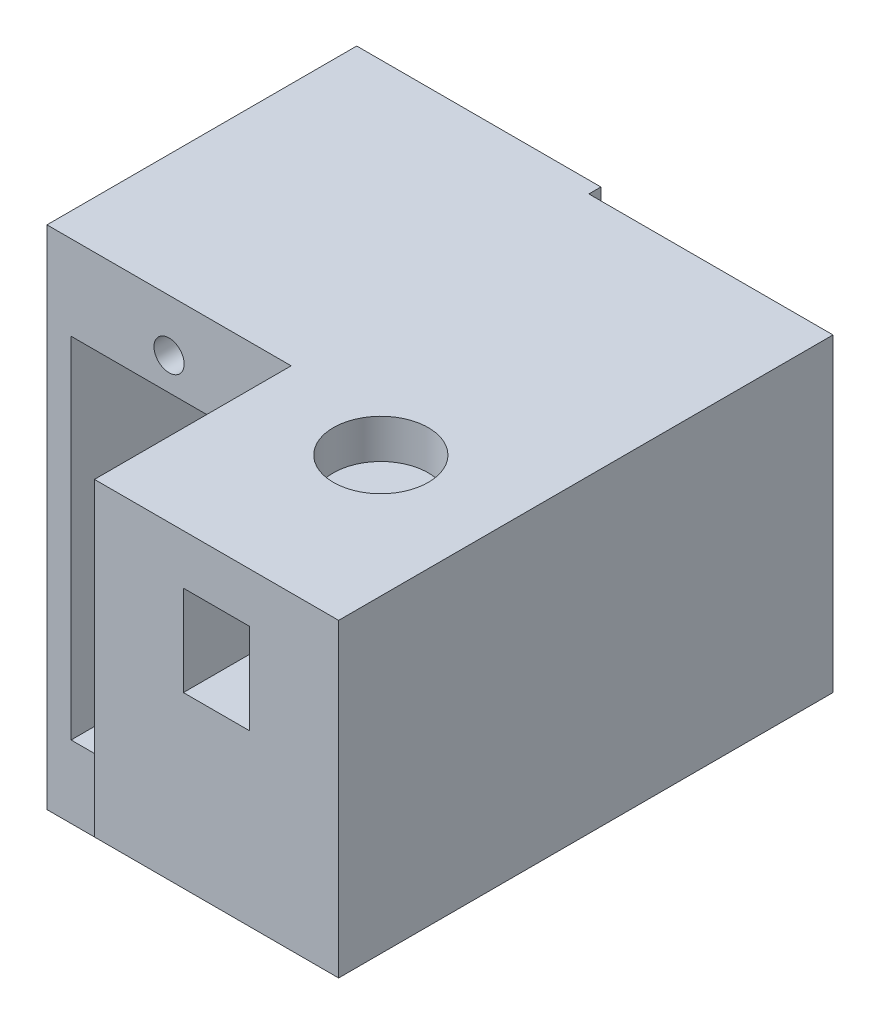
from build123d import *

# Parameters (mm, degrees)
BOSS_EXTRUDE1_START = -17.075
SKETCH1_W           = 16.2
SKETCH1_H           = 32.8
BOSS_EXTRUDE1_DEPTH = 10.275
BOSS_EXTRUDE2_START = -12.425
SKETCH2_W           = 16.2
SKETCH2_H           = 32.8
BOSS_EXTRUDE2_DEPTH = 10.275
BOSS_EXTRUDE3_START = -7.3
SKETCH3_W           = 16.2
SKETCH3_H           = 20.55
BOSS_EXTRUDE3_DEPTH = 0.5
CUT_EXTRUDE1_START  = -18.725
SKETCH4_W           = 13
SKETCH4_H           = 23.2
CUT_EXTRUDE1_DEPTH  = 8.625
CUT_EXTRUDE2_START  = -24.35
SKETCH5_R           = 1
CUT_EXTRUDE2_DEPTH  = 3
CUT_EXTRUDE3_START  = -24.35
SKETCH6_R           = 1
CUT_EXTRUDE3_DEPTH  = 3
CUT_EXTRUDE4_START  = -8.1
SKETCH7_R           = 3.15
CUT_EXTRUDE4_DEPTH  = 1.3
CUT_EXTRUDE5_START  = 8.5
SKETCH8_W           = 4.4
SKETCH8_H           = 6
CUT_EXTRUDE5_DEPTH  = 2.4
CUT_EXTRUDE6_START  = -10.775
SKETCH9_W           = 13
SKETCH9_H           = 23.2
CUT_EXTRUDE6_DEPTH  = 8.625
CUT_EXTRUDE7_START  = -5.15
SKETCH10_R          = 1
CUT_EXTRUDE7_DEPTH  = 3
CUT_EXTRUDE8_START  = -5.15
SKETCH11_R          = 1
CUT_EXTRUDE8_DEPTH  = 3
CUT_EXTRUDE9_START  = -21.4
SKETCH12_R          = 3.15
CUT_EXTRUDE9_DEPTH  = 1.3
CUT_EXTRUDE10_START = -10
SKETCH13_W          = 4.4
SKETCH13_H          = 6
CUT_EXTRUDE10_DEPTH = 2.4


with BuildPart() as part:
    # Sketch1 → Boss-Extrude1 (new, symmetric)
    with BuildSketch(Plane(origin=(0, 0, 0), x_dir=(1, 0, 0), z_dir=(0, 1, 0)).offset(BOSS_EXTRUDE1_START)):
        with Locations((0, 5.5)):
            Rectangle(SKETCH1_W, SKETCH1_H)
    extrude(amount=BOSS_EXTRUDE1_DEPTH, both=True)

    # Sketch2 → Boss-Extrude2 (add, symmetric)
    with BuildSketch(Plane.XY.offset(BOSS_EXTRUDE2_START)):
        with Locations((-16.2, -24)):
            Rectangle(SKETCH2_W, SKETCH2_H)
    extrude(amount=BOSS_EXTRUDE2_DEPTH, both=True)

    # Sketch3 → Boss-Extrude3 (add, symmetric)
    with BuildSketch(Plane(origin=(0, 0, 0), x_dir=(1, 0, 0), z_dir=(0, 1, 0)).offset(BOSS_EXTRUDE3_START)):
        with Locations((-16.2, 12.425)):
            Rectangle(SKETCH3_W, SKETCH3_H)
    extrude(amount=BOSS_EXTRUDE3_DEPTH, both=True)

    # Sketch4 → Cut-Extrude1 (cut, symmetric)
    with BuildSketch(Plane(origin=(0, 0, 0), x_dir=(1, 0, 0), z_dir=(0, 1, 0)).offset(CUT_EXTRUDE1_START)):
        with Locations((0, 5.5)):
            Rectangle(SKETCH4_W, SKETCH4_H)
    extrude(amount=CUT_EXTRUDE1_DEPTH, both=True, mode=Mode.SUBTRACT)

    # Sketch5 → Cut-Extrude2 (cut, symmetric)
    with BuildSketch(Plane(origin=(0, 0, 0), x_dir=(1, 0, 0), z_dir=(0, 1, 0)).offset(CUT_EXTRUDE2_START)):
        with Locations(Location((0, 19.25, 0), (0, 0, 270))):
            Circle(SKETCH5_R)
    extrude(amount=CUT_EXTRUDE2_DEPTH, both=True, mode=Mode.SUBTRACT)

    # Sketch6 → Cut-Extrude3 (cut, symmetric)
    with BuildSketch(Plane(origin=(0, 0, 0), x_dir=(1, 0, 0), z_dir=(0, 1, 0)).offset(CUT_EXTRUDE3_START)):
        with Locations(Location((0, -8.25, 0), (0, 0, 270))):
            Circle(SKETCH6_R)
    extrude(amount=CUT_EXTRUDE3_DEPTH, both=True, mode=Mode.SUBTRACT)

    # Sketch7 → Cut-Extrude4 (cut, symmetric)
    with BuildSketch(Plane(origin=(0, 0, 0), x_dir=(1, 0, 0), z_dir=(0, 1, 0)).offset(CUT_EXTRUDE4_START)):
        with Locations(Location((0, 0, 0), (0, 0, 270))):
            Circle(SKETCH7_R)
    extrude(amount=CUT_EXTRUDE4_DEPTH, both=True, mode=Mode.SUBTRACT)

    # Sketch8 → Cut-Extrude5 (cut, symmetric)
    with BuildSketch(Plane.XY.offset(CUT_EXTRUDE5_START)):
        with Locations((0, -13.1)):
            Rectangle(SKETCH8_W, SKETCH8_H)
    extrude(amount=CUT_EXTRUDE5_DEPTH, both=True, mode=Mode.SUBTRACT)

    # Sketch9 → Cut-Extrude6 (cut, symmetric)
    with BuildSketch(Plane.XY.offset(CUT_EXTRUDE6_START)):
        with Locations((-16.2, -24)):
            Rectangle(SKETCH9_W, SKETCH9_H)
    extrude(amount=CUT_EXTRUDE6_DEPTH, both=True, mode=Mode.SUBTRACT)

    # Sketch10 → Cut-Extrude7 (cut, symmetric)
    with BuildSketch(Plane.XY.offset(CUT_EXTRUDE7_START)):
        with Locations((-16.2, -37.75)):
            Circle(SKETCH10_R)
    extrude(amount=CUT_EXTRUDE7_DEPTH, both=True, mode=Mode.SUBTRACT)

    # Sketch11 → Cut-Extrude8 (cut, symmetric)
    with BuildSketch(Plane.XY.offset(CUT_EXTRUDE8_START)):
        with Locations((-16.2, -10.25)):
            Circle(SKETCH11_R)
    extrude(amount=CUT_EXTRUDE8_DEPTH, both=True, mode=Mode.SUBTRACT)

    # Sketch12 → Cut-Extrude9 (cut, symmetric)
    with BuildSketch(Plane.XY.offset(CUT_EXTRUDE9_START)):
        with Locations((-16.2, -18.5)):
            Circle(SKETCH12_R)
    extrude(amount=CUT_EXTRUDE9_DEPTH, both=True, mode=Mode.SUBTRACT)

    # Sketch13 → Cut-Extrude10 (cut, symmetric)
    with BuildSketch(Plane(origin=(0, 0, 0), x_dir=(1, 0, 0), z_dir=(0, 1, 0)).offset(CUT_EXTRUDE10_START)):
        with Locations((-16.2, 16.4)):
            Rectangle(SKETCH13_W, SKETCH13_H)
    extrude(amount=CUT_EXTRUDE10_DEPTH, both=True, mode=Mode.SUBTRACT)


solid = part.part
